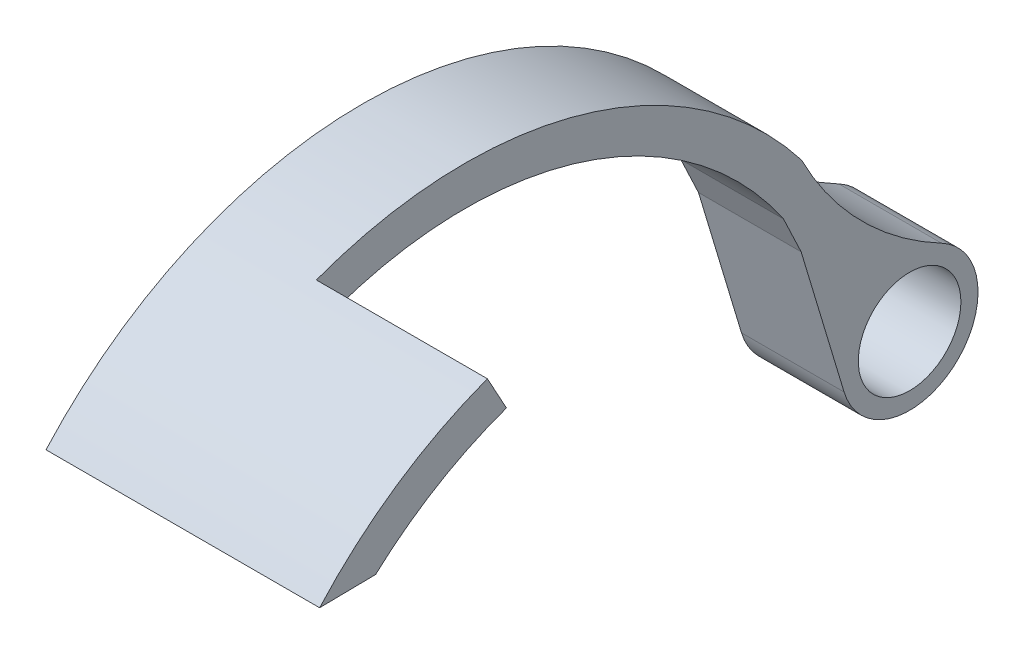
from build123d import *

# Parameters (mm, degrees)
SKETCH8_R           = 1.5
BOSS_EXTRUDE3_DEPTH = 3
BOSS_EXTRUDE4_DEPTH = 5


with BuildPart() as part:
    # Sketch8 → Boss-Extrude3 (new body)
    with BuildSketch(Plane(origin=(0, 0, 0), x_dir=(0, 0, -1), z_dir=(1, 0, 0))):
        with BuildLine():
            ThreePointArc((13.132863069, 0.320027848), (3.75419069, 5.150346209), (-5.956033277, 1.026874177))
            Line((-5.956033277, 1.026874177), (-4.319797484, 1.050447619))
            ThreePointArc((-4.319797484, 1.050447619), (4.590085283, 3.936033014), (12.605766771, -0.907670556))
            Line((12.605766771, -0.907670556), (13.12184584, -1.999779955))
            Line((13.12184584, -1.999779955), (14.377901927, -6.177963459))
            ThreePointArc((14.377901927, -6.177963459), (17.56376003, -7.146759051), (17.227616297, -3.83386543))
            ThreePointArc((17.227616297, -3.83386543), (14.859483295, -2.073108487), (13.132863069, 0.320027848))
        make_face()
        with Locations((16.293226017, -5.602173889)):
            Circle(SKETCH8_R, mode=Mode.SUBTRACT)
    extrude(amount=BOSS_EXTRUDE3_DEPTH)

    # Sketch10 → Boss-Extrude4 (add)
    with BuildSketch(Plane(origin=(3, 0, 0), x_dir=(0, 0, -1), z_dir=(1, 0, 0))):
        with BuildLine():
            Line((-5.956033277, 1.026874177), (-4.319797484, 1.050447619))
            ThreePointArc((-4.319797484, 1.050447619), (-2.522150549, 2.39412043), (-0.493946712, 3.355047235))
            Line((-0.493946712, 3.355047235), (-1.051379481, 4.37374771))
            ThreePointArc((-1.051379481, 4.37374771), (-3.706640914, 2.997700023), (-5.956033277, 1.026874177))
        make_face()
    extrude(amount=BOSS_EXTRUDE4_DEPTH)


solid = part.part
